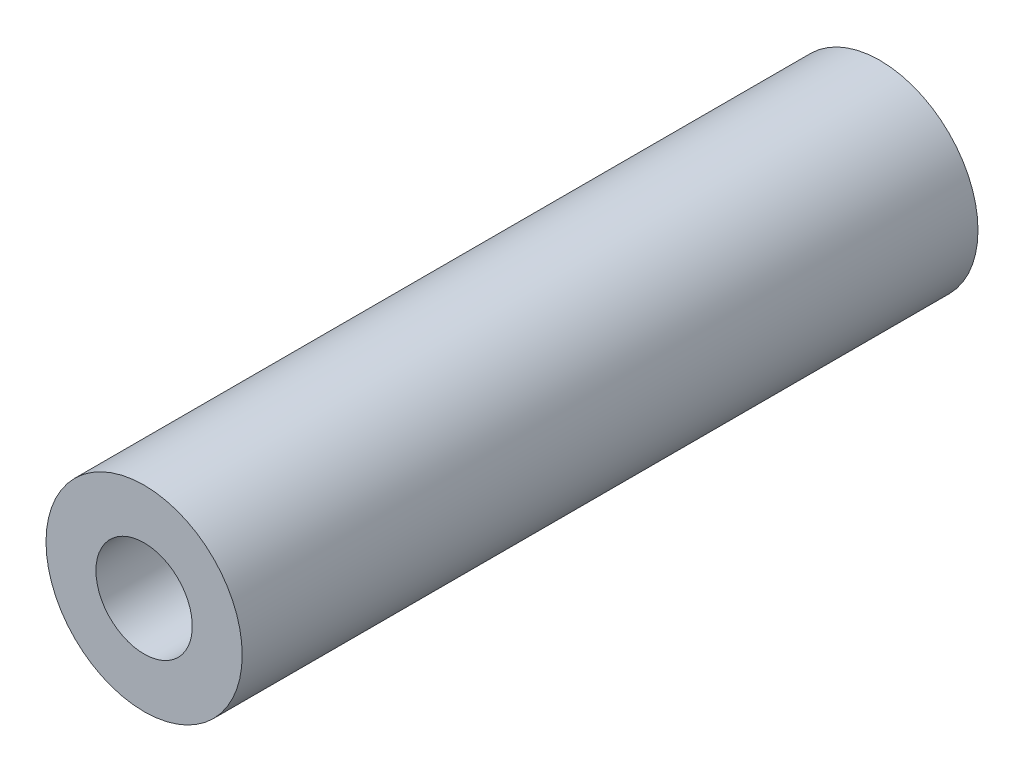
from build123d import *

# Parameters (mm, degrees)
SKETCH2_R               = 5.08
BOSS_EXTRUDE1_DEPTH     = 38.1
CUT_EXTRUDE1_DEPTH      = 39.771417307
CUT_EXTRUDE1_DEPTH_BACK = 39.771417307
SKETCH3_R               = 2.494846457


with BuildPart() as part:
    # Sketch2 → Boss-Extrude1 (new body)
    with BuildSketch(Plane.XY):
        with Locations(Location((0, 0, 0), (0, 0, 180))):
            Circle(SKETCH2_R)
    extrude(amount=BOSS_EXTRUDE1_DEPTH)

    # Sketch3 → Cut-Extrude1 (cut, two sides: drawn at the far end of the back side and taken through both)
    with BuildSketch(Plane(origin=(0, 0, 0), x_dir=(-1, 0, 0), z_dir=(0, 0, -1)).offset(-CUT_EXTRUDE1_DEPTH_BACK)):
        Circle(SKETCH3_R)
    extrude(amount=CUT_EXTRUDE1_DEPTH + CUT_EXTRUDE1_DEPTH_BACK, mode=Mode.SUBTRACT)


solid = part.part
